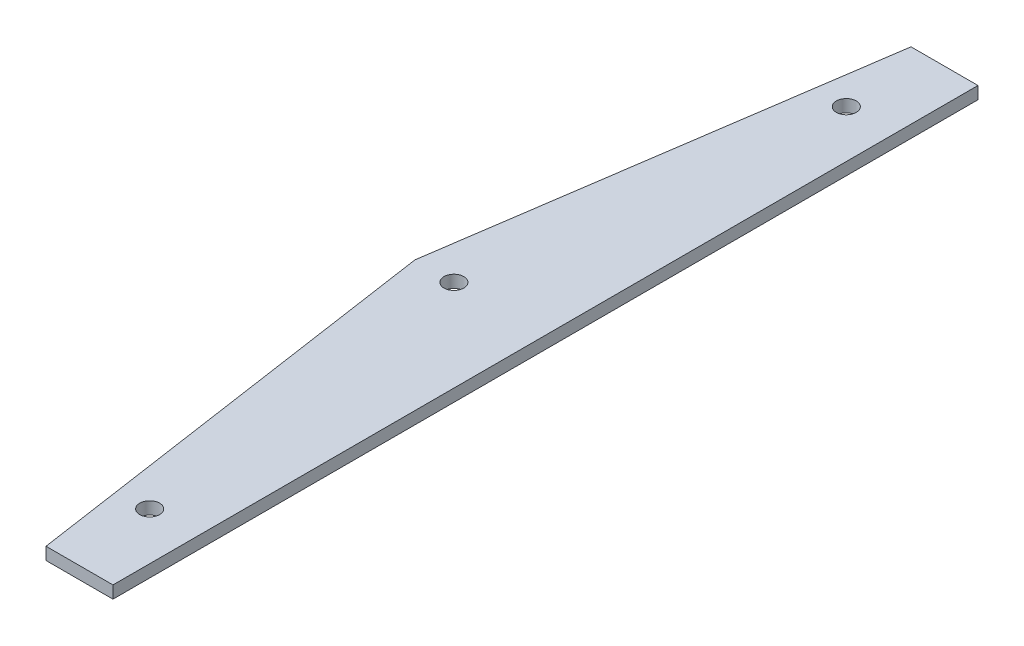
from build123d import *

# Parameters (mm, degrees)
SKETCH1_R           = 2.5527
BOSS_EXTRUDE1_DEPTH = 3.175


with BuildPart() as part:
    # Sketch1 → Boss-Extrude1 (new body)
    with BuildSketch(Plane(origin=(0, 7.659460084, 0), x_dir=(1, 0, 0), z_dir=(0, 1, 0))):
        Polygon((-141.5163305, 104.251042847), (-124.323681089, 104.251042847), (-124.323681089, -117.799669373), (-141.5163305, -117.799669373), (-157.82954988, -6.774313263), align=None)
        with Locations(Location((-136.5163305, -96.185148791, 0), (0, 0, 270))):
            Circle(SKETCH1_R, mode=Mode.SUBTRACT)
        with Locations(Location((-147.82954988, -6.774313263, 0), (0, 0, 270))):
            Circle(SKETCH1_R, mode=Mode.SUBTRACT)
        with Locations(Location((-136.5163305, 82.636522264, 0), (0, 0, 270))):
            Circle(SKETCH1_R, mode=Mode.SUBTRACT)
    extrude(amount=-BOSS_EXTRUDE1_DEPTH)


solid = part.part
